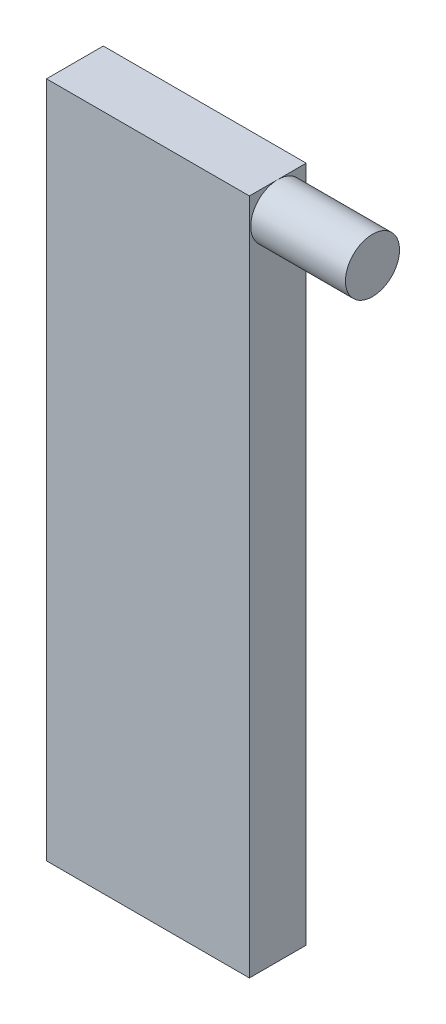
from build123d import *

# Parameters (mm, degrees)
SKETCH1_W           = 15
SKETCH1_H           = 50.07
BOSS_EXTRUDE1_DEPTH = 4.2
SKETCH2_R           = 2
BOSS_EXTRUDE2_DEPTH = 7


with BuildPart() as part:
    # Sketch1 → Boss-Extrude1 (new body)
    with BuildSketch(Plane.XY):
        with Locations((-57.808285707, -151.395582189)):
            Rectangle(SKETCH1_W, SKETCH1_H)
    extrude(amount=BOSS_EXTRUDE1_DEPTH)

    # Sketch2 → Boss-Extrude2 (add)
    with BuildSketch(Plane(origin=(-50.308285707, 0, 0), x_dir=(0, 0, -1), z_dir=(1, 0, 0))):
        with Locations(Location((-2.1, -128.360582189, 0), (0, 0, 90))):
            Circle(SKETCH2_R)
    extrude(amount=BOSS_EXTRUDE2_DEPTH)


solid = part.part
